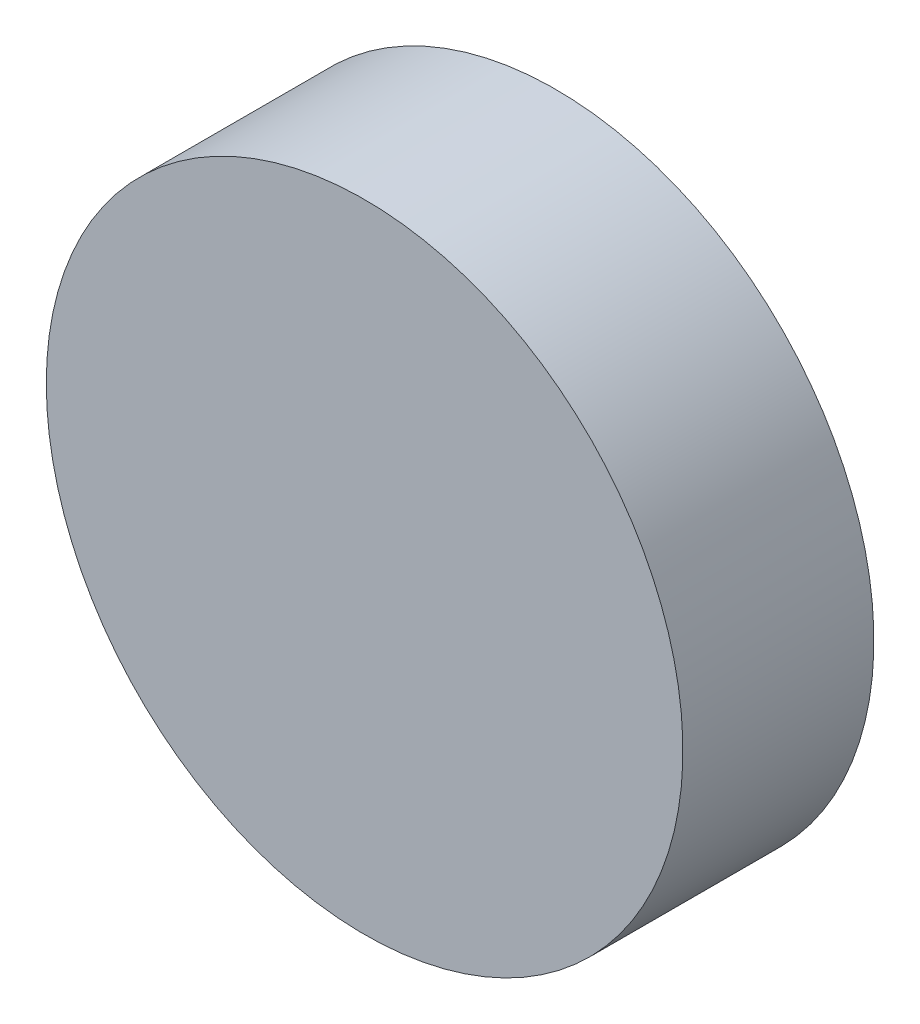
from build123d import *


with BuildPart() as part:
    # Sketch1 → Revolve1 (revolve)
    with BuildSketch(Plane(origin=(0, 0, 0), x_dir=(1, 0, 0), z_dir=(0, 1, 0))):
        Polygon((-25, -15), (0, -15), (0, -10), (-15, -10), (-15, 0), (-25, 0), align=None)
    revolve(axis=Axis((0, 0, 0), (0, 0, 1)))


solid = part.part
